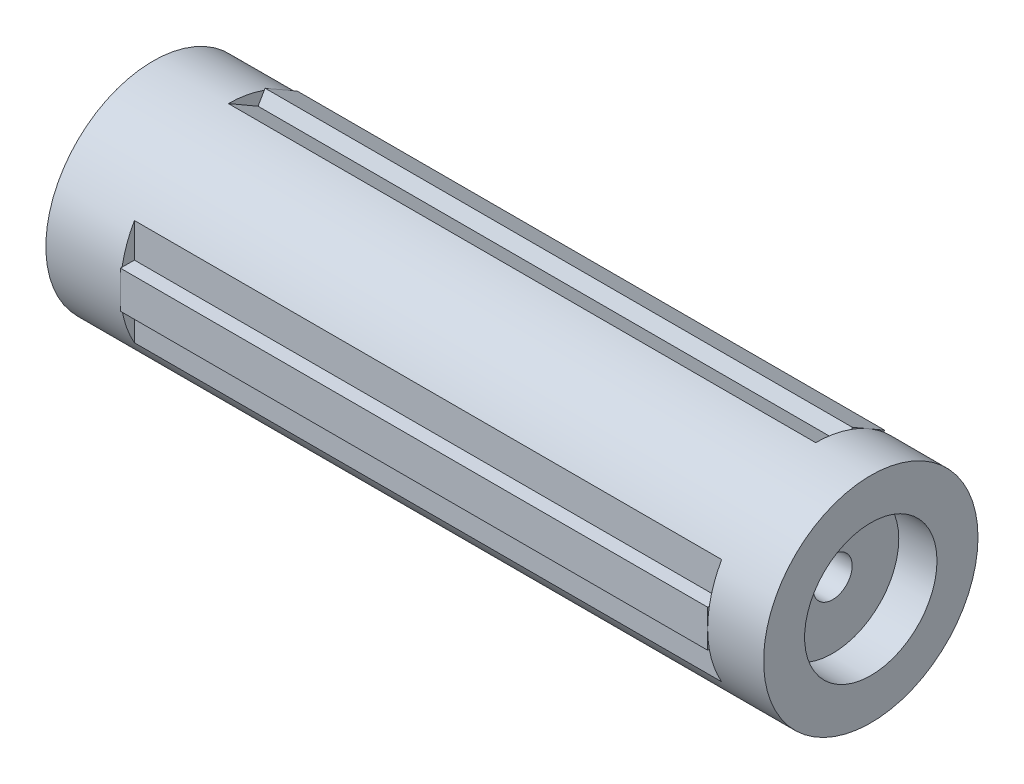
from build123d import *

# Parameters (mm, degrees)
SKIZZE1_R                       = 11.5
AUFSATZ_LINEAR_AUSTRAGEN1_DEPTH = 77
SKIZZE2_R                       = 7.1
SCHNITT_LINEAR_AUSTRAGEN1_DEPTH = 4.1
SKIZZE3_R                       = 2.1
SCHNITT_LINEAR_AUSTRAGEN2_DEPTH = 3
SKIZZE4_R                       = 9.6
SCHNITT_LINEAR_AUSTRAGEN3_DEPTH = 12.75
SCHNITT_LINEAR_START            = -6
SKIZZE7_W                       = 1.5
SKIZZE7_H                       = 15
SCHNITT_LINEAR_AUSTRAGEN4_DEPTH = 63
SKIZZE8_W                       = 63
SKIZZE8_H                       = 4
AUFSATZ_LINEAR_AUSTRAGEN2_DEPTH = 1.5
SCHNITT_LINEAR_AUSTRAGEN6_DEPTH = 13.5
SKIZZE12_R                      = 3
SCHNITT_LINEAR_AUSTRAGEN7_DEPTH = 2
KREISMUSTER3_COUNT              = 3
SKIZZE13_R                      = 8.5
SCHNITT_LINEAR_AUSTRAGEN8_DEPTH = 40


with BuildPart() as part:
    # Skizze1 → Aufsatz-Linear austragen1 (new body)
    with BuildSketch(Plane(origin=(0, 0, 0), x_dir=(0, 0, -1), z_dir=(1, 0, 0))):
        Circle(SKIZZE1_R)
    extrude(amount=AUFSATZ_LINEAR_AUSTRAGEN1_DEPTH)

    # Skizze2 → Schnitt-Linear austragen1 (cut)
    with BuildSketch(Plane(origin=(77, 0, 0), x_dir=(0, 0, -1), z_dir=(1, 0, 0))):
        Circle(SKIZZE2_R)
    extrude(amount=-SCHNITT_LINEAR_AUSTRAGEN1_DEPTH, mode=Mode.SUBTRACT)

    # Skizze3 → Schnitt-Linear austragen2 (cut)
    with BuildSketch(Plane(origin=(72.9, 0, 0), x_dir=(0, 0, -1), z_dir=(1, 0, 0))):
        Circle(SKIZZE3_R)
    extrude(amount=-SCHNITT_LINEAR_AUSTRAGEN2_DEPTH, mode=Mode.SUBTRACT)

    # Skizze4 → Schnitt-Linear austragen3 (cut)
    with BuildSketch(Plane.ZY):
        Circle(SKIZZE4_R)
    extrude(amount=-SCHNITT_LINEAR_AUSTRAGEN3_DEPTH, mode=Mode.SUBTRACT)

    # Skizze7 → Schnitt-Linear austragen4 (cut)
    with BuildSketch(Plane(origin=(77, 0, 0), x_dir=(0, 0, -1), z_dir=(1, 0, 0)).offset(SCHNITT_LINEAR_START)):
        with Locations((-10.75, 0)):
            Rectangle(SKIZZE7_W, SKIZZE7_H)
    schnitt_linear_austragen4 = extrude(amount=-SCHNITT_LINEAR_AUSTRAGEN4_DEPTH, mode=Mode.SUBTRACT)

    # Skizze8 → Aufsatz-Linear austragen2 (add)
    with BuildSketch(Plane.XY.offset(10)):
        with Locations((39.5, 0)):
            Rectangle(SKIZZE8_W, SKIZZE8_H)
    aufsatz_linear_austragen2 = extrude(amount=AUFSATZ_LINEAR_AUSTRAGEN2_DEPTH)

    # Skizze10 → Schnitt-Linear austragen6 (cut)
    with BuildSketch(Plane.ZY.offset(-12.75)):
        Polygon((4.038863706, -2.240739453), (3.959969143, 2.377388845), (-0.078894563, 4.618128298), (-4.038863706, 2.240739453), (-3.959969143, -2.377388845), (0.078894563, -4.618128298), align=None)
    extrude(amount=-SCHNITT_LINEAR_AUSTRAGEN6_DEPTH, mode=Mode.SUBTRACT)

    # Skizze12 → Schnitt-Linear austragen7 (cut)
    with BuildSketch(Plane.ZY.offset(-26.25)):
        Circle(SKIZZE12_R)
    extrude(amount=-SCHNITT_LINEAR_AUSTRAGEN7_DEPTH, mode=Mode.SUBTRACT)

    # Kreismuster3: Schnitt-Linear austragen4, Aufsatz-Linear austragen2 ×3 about axis
    kreismuster3_axis = Axis((0, 0, 0), (1, 0, 0))
    add([schnitt_linear_austragen4.rotate(kreismuster3_axis, i * 360 / KREISMUSTER3_COUNT) for i in range(1, KREISMUSTER3_COUNT)], mode=Mode.SUBTRACT)
    add([aufsatz_linear_austragen2.rotate(kreismuster3_axis, i * 360 / KREISMUSTER3_COUNT) for i in range(1, KREISMUSTER3_COUNT)])

    # Skizze13 → Schnitt-Linear austragen8 (cut)
    with BuildSketch(Plane(origin=(69.9, 0, 0), x_dir=(0, 0, -1), z_dir=(1, 0, 0))):
        Circle(SKIZZE13_R)
    extrude(amount=-SCHNITT_LINEAR_AUSTRAGEN8_DEPTH, mode=Mode.SUBTRACT)


solid = part.part
